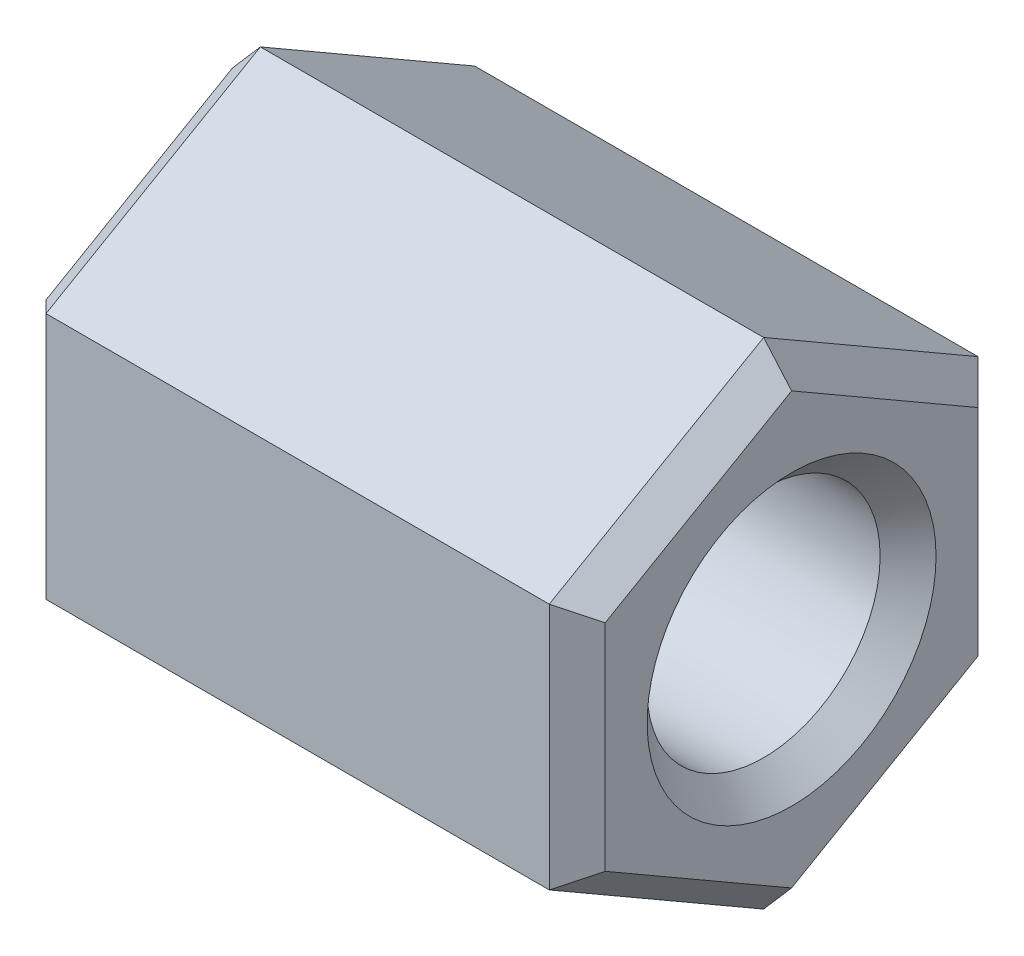
from build123d import *

# Parameters (mm, degrees)
SKETCH_1_R      = 1.25
EXTRUDE_1_DEPTH = 6
CHAMFER_1_SIZE  = 0.3


with BuildPart() as part:
    # 草图1 → 凸台-拉伸1 (new body)
    with BuildSketch(Plane.YZ):
        Polygon((2.655811238, 0), (1.327905619, 2.3), (-1.327905619, 2.3), (-2.655811238, 0), (-1.327905619, -2.3), (1.327905619, -2.3), align=None)
        with Locations(Location((0, 0, 0), (0, 0, 270))):
            Circle(SKETCH_1_R, mode=Mode.SUBTRACT)
    extrude(amount=EXTRUDE_1_DEPTH)

    # 倒角1
    chamfer_1_edges = [part.edges().sort_by_distance(p)[0] for p in [
        (6, 0, 2.3),
        (6, -1.991858429, 1.15),
        (0, 0, 1.25),
        (6, 0, 1.25),
        (6, -1.991858429, -1.15),
        (6, 0, -2.3),
        (6, 1.991858429, -1.15),
        (0, 0, -2.3),
        (0, -1.991858429, -1.15),
        (0, -1.991858429, 1.15),
        (0, 0, 2.3),
        (0, 1.991858429, 1.15),
        (0, 1.991858429, -1.15),
        (6, 1.991858429, 1.15),
    ]]
    chamfer(chamfer_1_edges, length=CHAMFER_1_SIZE)


solid = part.part
